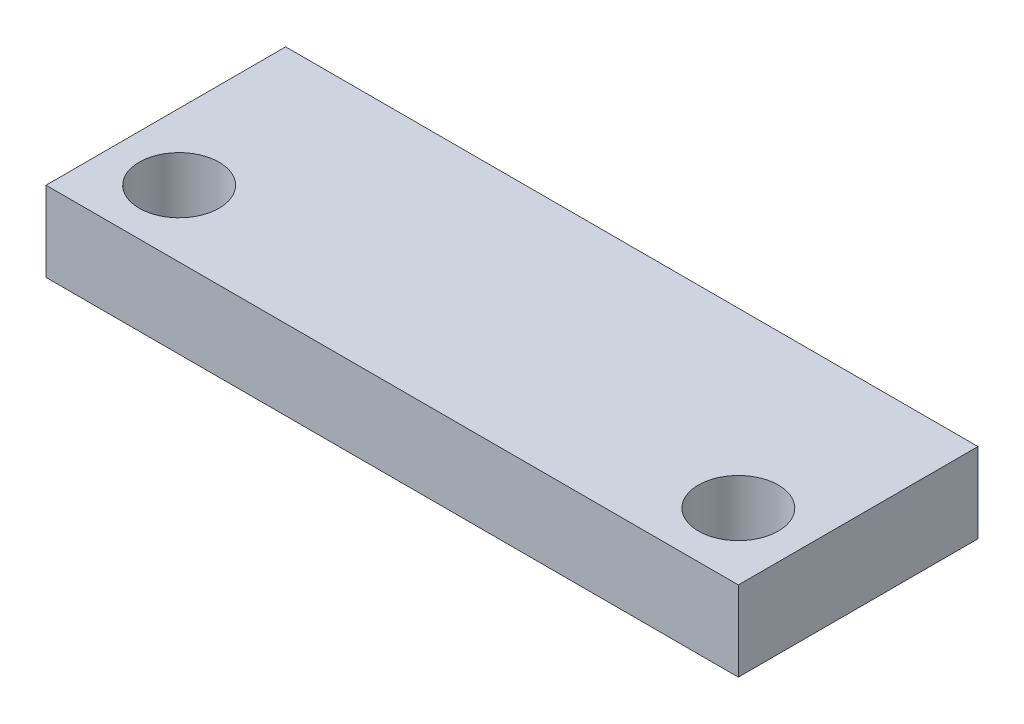
from build123d import *

# Parameters (mm, degrees)
SZKIC1_W                    = 26
SZKIC1_H                    = 9
SZKIC1_R                    = 1.5
DODANIE_WYCI_GNI_CIE1_DEPTH = 3


with BuildPart() as part:
    # Szkic1 → Dodanie-wyciągnięcie1 (new body)
    with BuildSketch(Plane(origin=(0, 0, 0), x_dir=(1, 0, 0), z_dir=(0, 1, 0))):
        with Locations((13, 4.5)):
            Rectangle(SZKIC1_W, SZKIC1_H)
        with Locations(Location((2.5, 2.5, 0), (0, 0, 270))):
            Circle(SZKIC1_R, mode=Mode.SUBTRACT)
        with Locations(Location((23.5, 2.5, 0), (0, 0, 90))):
            Circle(SZKIC1_R, mode=Mode.SUBTRACT)
    extrude(amount=DODANIE_WYCI_GNI_CIE1_DEPTH)


solid = part.part
